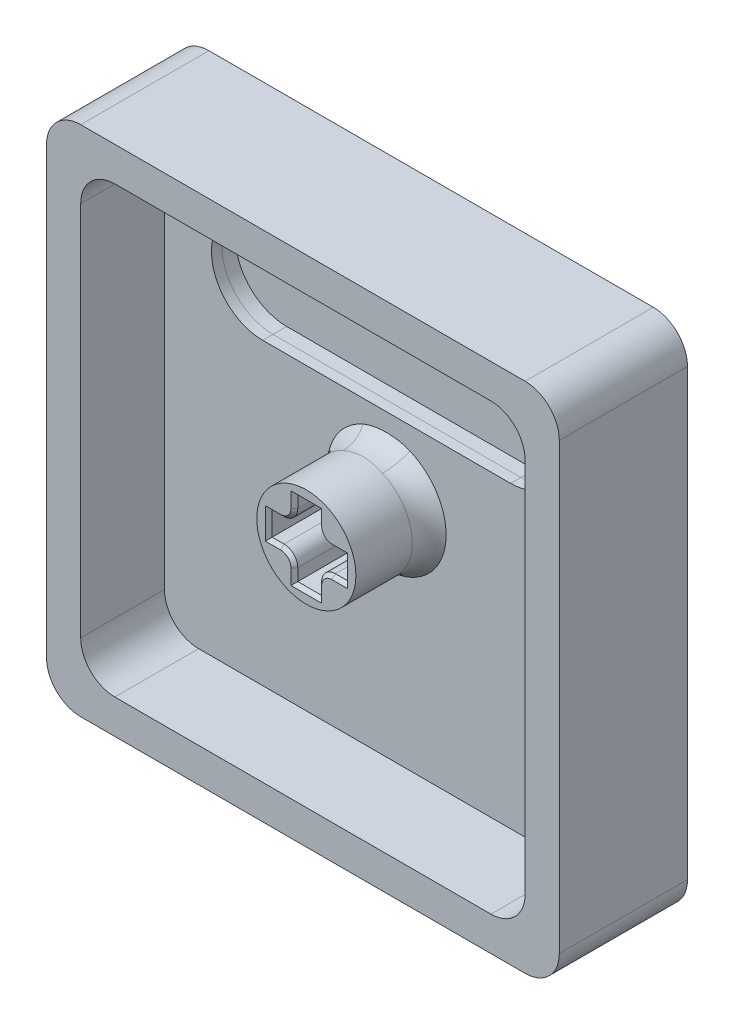
from build123d import *

# Parameters (mm, degrees)
EXTRUDE_1_DEPTH     = 5.5
SKETCH_1_6_R        = 2.9
EXTRUDE_2_DEPTH     = 5.3
EXTRUDE_START       = -2
EXTRUDE_3_DEPTH     = 2
EXTRUDE_4_DEPTH     = 2
CUT_EXTRUDE_1_REACH = 23.915
EXTRUDE_6_DEPTH     = 1.2
SKETCH_7_R          = 2.9
EXTRUDE_7_DEPTH     = 0.6
FILLET_4_R          = 0.8
CHAMFER_1_SIZE      = 0.2
FILLET_5_R          = 2


with BuildPart() as part:
    # 草图1 → 凸台-拉伸1 (new body)
    with BuildSketch(Plane.XY):
        with BuildLine():
            ThreePointArc((-15, 13), (-14.414213562, 14.414213562), (-13, 15))
            Line((-13, 15), (13, 15))
            ThreePointArc((13, 15), (14.414213562, 14.414213562), (15, 13))
            Line((15, 13), (15, -13))
            ThreePointArc((15, -13), (14.414213562, -14.414213562), (13, -15))
            Line((13, -15), (-13, -15))
            ThreePointArc((-13, -15), (-14.414213562, -14.414213562), (-15, -13))
            Line((-15, -13), (-15, 13))
        make_face()
        with BuildLine():
            ThreePointArc((-13, -11), (-12.414213562, -12.414213562), (-11, -13))
            Line((-11, -13), (11, -13))
            ThreePointArc((11, -13), (12.414213562, -12.414213562), (13, -11))
            Line((13, -11), (13, 11))
            ThreePointArc((13, 11), (12.414213562, 12.414213562), (11, 13))
            Line((11, 13), (-11, 13))
            ThreePointArc((-11, 13), (-12.414213562, 12.414213562), (-13, 11))
            Line((-13, 11), (-13, -11))
        make_face(mode=Mode.SUBTRACT)
    extrude(amount=EXTRUDE_1_DEPTH)



with BuildPart() as body_2:
    # 草图1<6> → 凸台-拉伸2 (new body)
    with BuildSketch(Plane.XY):
        Circle(SKETCH_1_6_R)
        Polygon((-2.2, -0.7), (-2.2, 0.7), (-0.7, 0.7), (-0.7, 2.2), (0.7, 2.2), (0.7, 0.7), (2.2, 0.7), (2.2, -0.7), (0.7, -0.7), (0.7, -2.2), (-0.7, -2.2), (-0.7, -0.7), align=None, mode=Mode.SUBTRACT)
    extrude(amount=EXTRUDE_2_DEPTH)


with BuildPart() as part_1:
    add(part.part)

    add(body_2.part)  # 凸台-拉伸3 merges body 2
    # 草图1<7> → 凸台-拉伸3 (add)
    with BuildSketch(Plane.XY.offset(EXTRUDE_START)):
        with BuildLine():
            Line((-13, 15), (13, 15))
            ThreePointArc((13, 15), (14.414213562, 14.414213562), (15, 13))
            Line((15, 13), (15, -13))
            ThreePointArc((15, -13), (14.414213562, -14.414213562), (13, -15))
            Line((13, -15), (-13, -15))
            ThreePointArc((-13, -15), (-14.414213562, -14.414213562), (-15, -13))
            Line((-15, -13), (-15, 13))
            ThreePointArc((-15, 13), (-14.414213562, 14.414213562), (-13, 15))
        make_face()
    extrude(amount=EXTRUDE_3_DEPTH)

    # 草图3 → 凸台-拉伸4 (add)
    with BuildSketch(Plane.XY):
        Polygon((0.7, 0.7), (0.7, 2.2), (-0.7, 2.2), (-0.7, 0.7), (-2.2, 0.7), (-2.2, -0.7), (-0.7, -0.7), (-0.7, -2.2), (0.7, -2.2), (0.7, -0.7), (2.2, -0.7), (2.2, 0.7), align=None)
    extrude(amount=EXTRUDE_4_DEPTH)

    # 草图5 → 切除-拉伸1 (cut, up to next)
    with BuildSketch(Plane.XY, mode=Mode.PRIVATE) as cut_extrude_1_sk1:
        with BuildLine():
            Line((7.25, 4.5), (-7.25, 4.5))
            ThreePointArc((-7.25, 4.5), (-10.25, 7.5), (-7.25, 10.5))
            Line((-7.25, 10.5), (7.25, 10.5))
            ThreePointArc((7.25, 10.5), (10.25, 7.5), (7.25, 4.5))
        make_face()
    cut_extrude_1_tool1 = extrude(cut_extrude_1_sk1.sketch, amount=-CUT_EXTRUDE_1_REACH, mode=Mode.PRIVATE) & part_1.part
    add(cut_extrude_1_tool1.solids().sort_by_distance((0, 7.5, 0))[0], mode=Mode.SUBTRACT)

    # 圆角4
    fillet_4_edges = [part_1.edges().sort_by_distance(p)[0] for p in [
        (0.7, 0.7, 3.65),
        (0.7, -0.7, 3.65),
        (-0.7, -0.7, 3.65),
        (-0.7, 0.7, 3.65),
    ]]
    fillet(fillet_4_edges, radius=FILLET_4_R)

    # 倒角1
    chamfer_1_edges = [part_1.edges().sort_by_distance(p)[0] for p in [
        (1.85, 0.7, 5.3),
        (1.85, -0.7, 5.3),
        (0.7, -1.85, 5.3),
        (-0.7, -1.85, 5.3),
        (0.934314575, -0.934314575, 5.3),
        (-0.934314575, -0.934314575, 5.3),
        (0.934314575, 0.934314575, 5.3),
        (-0.934314575, 0.934314575, 5.3),
        (0, -2.2, 5.3),
        (-1.85, -0.7, 5.3),
        (-2.2, 0, 5.3),
        (-0.7, 1.85, 5.3),
        (0, 2.2, 5.3),
        (0.7, 1.85, 5.3),
        (2.2, 0, 5.3),
        (-1.85, 0.7, 5.3),
    ]]
    chamfer(chamfer_1_edges, length=CHAMFER_1_SIZE)

    # 圆角5
    fillet_5_edges = [part_1.edges().sort_by_distance(p)[0] for p in [
        (-2.9, 0, 0),
    ]]
    fillet(fillet_5_edges, radius=FILLET_5_R)


with BuildPart() as body_2_2:
    # 草图6 → 凸台-拉伸6 (new body)
    with BuildSketch(Plane(origin=(0, 0, -2), x_dir=(-1, 0, 0), z_dir=(0, 0, -1))):
        with BuildLine():
            Line((7.25, 4.5), (-7.25, 4.5))
            ThreePointArc((-7.25, 4.5), (-10.25, 7.5), (-7.25, 10.5))
            Line((-7.25, 10.5), (7.25, 10.5))
            ThreePointArc((7.25, 10.5), (10.25, 7.5), (7.25, 4.5))
        make_face()
    extrude(amount=-EXTRUDE_6_DEPTH)


with BuildPart() as body_3:
    # 草图7 → 凸台-拉伸7 (new body)
    with BuildSketch(Plane.XY):
        with BuildLine():
            Line((-13, 11), (-13, -11))
            ThreePointArc((-13, -11), (-12.414213562, -12.414213562), (-11, -13))
            Line((-11, -13), (11, -13))
            ThreePointArc((11, -13), (12.414213562, -12.414213562), (13, -11))
            Line((13, -11), (13, 11))
            ThreePointArc((13, 11), (12.414213562, 12.414213562), (11, 13))
            Line((11, 13), (-11, 13))
            ThreePointArc((-11, 13), (-12.414213562, 12.414213562), (-13, 11))
        make_face()
        Circle(SKETCH_7_R, mode=Mode.SUBTRACT)
        with BuildLine():
            Line((7.25, 4.5), (-7.25, 4.5))
            ThreePointArc((-7.25, 4.5), (-10.25, 7.5), (-7.25, 10.5))
            Line((-7.25, 10.5), (7.25, 10.5))
            ThreePointArc((7.25, 10.5), (10.25, 7.5), (7.25, 4.5))
        make_face(mode=Mode.SUBTRACT)
    extrude(amount=EXTRUDE_7_DEPTH)


solid = Compound([part_1.part, body_2_2.part, body_3.part])
